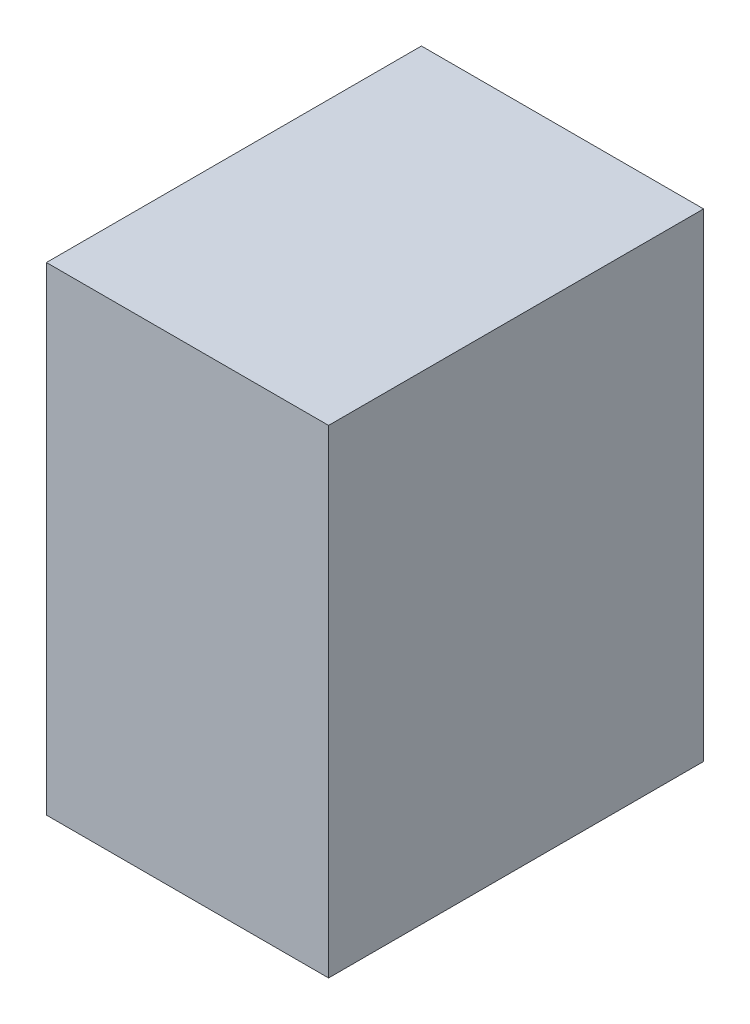
from build123d import *

# Parameters (mm, degrees)
SKETCH1_W               = 0.7524
SKETCH1_H               = 1.2762
COMPONENT_OUTLINE_DEPTH = 1


with BuildPart() as part:
    # Sketch1 → Component_Outline (new body)
    with BuildSketch(Plane.XY):
        with Locations((0, 0.0381)):
            Rectangle(SKETCH1_W, SKETCH1_H)
    extrude(amount=COMPONENT_OUTLINE_DEPTH)


solid = part.part
